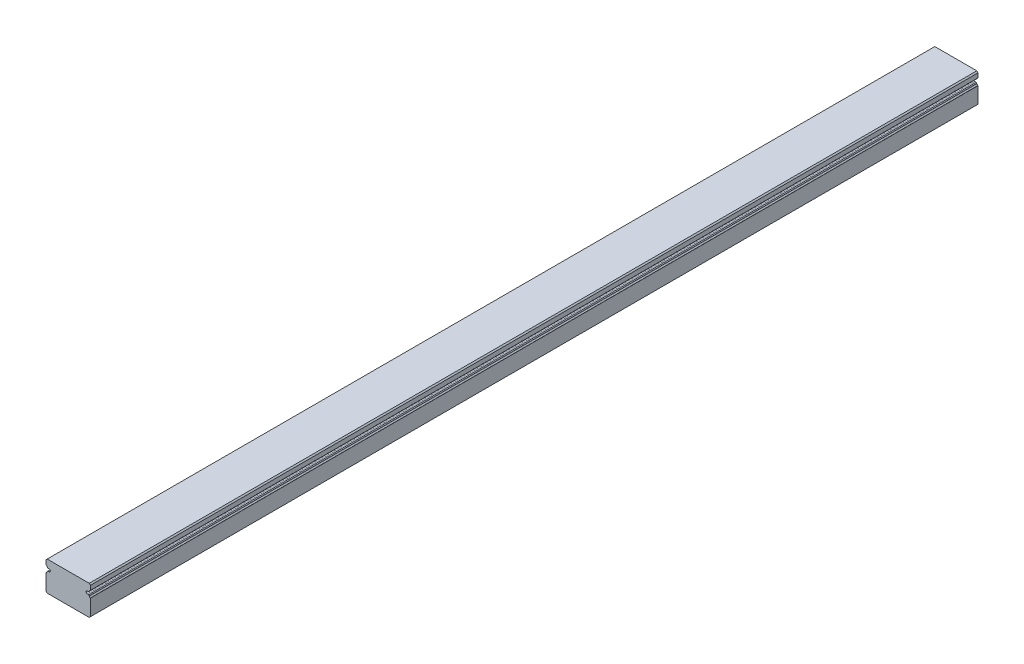
from build123d import *

# Parameters (mm, degrees)
EXTRUDE_273_DEPTH = 150


with BuildPart() as part:
    # Model → Extrude 273 (new, symmetric)
    with BuildSketch(Plane.XY):
        with BuildLine():
            Line((-7.1, -5), (7.1, -5))
            Line((7.1, -5), (7.5, -4.6))
            Line((7.5, -4.6), (7.5, 0.85))
            Line((7.5, 0.85), (7.463929973, 0.892081698))
            ThreePointArc((7.463929973, 0.892081698), (7.2158211, 1.027882975), (7.119563548, 1.293842528))
            Line((7.119563548, 1.293842528), (6.9, 1.55))
            Line((6.9, 1.55), (6.5, 1.55))
            ThreePointArc((6.5, 1.55), (6.05, 2), (6.5, 2.45))
            Line((6.5, 2.45), (6.9, 2.45))
            Line((6.9, 2.45), (7.119563548, 2.706157472))
            ThreePointArc((7.119563548, 2.706157472), (7.2158211, 2.972117025), (7.463929973, 3.107918302))
            Line((7.463929973, 3.107918302), (7.5, 3.15))
            Line((7.5, 3.15), (7.5, 4.6))
            Line((7.5, 4.6), (7.1, 5))
            Line((7.1, 5), (-7.1, 5))
            Line((-7.1, 5), (-7.5, 4.6))
            Line((-7.5, 4.6), (-7.5, 3.15))
            Line((-7.5, 3.15), (-7.463929973, 3.107918302))
            ThreePointArc((-7.463929973, 3.107918302), (-7.2158211, 2.972117025), (-7.119563548, 2.706157472))
            Line((-7.119563548, 2.706157472), (-6.9, 2.45))
            Line((-6.9, 2.45), (-6.5, 2.45))
            ThreePointArc((-6.5, 2.45), (-6.05, 2), (-6.5, 1.55))
            Line((-6.5, 1.55), (-6.9, 1.55))
            Line((-6.9, 1.55), (-7.119563548, 1.293842528))
            ThreePointArc((-7.119563548, 1.293842528), (-7.2158211, 1.027882975), (-7.463929973, 0.892081698))
            Line((-7.463929973, 0.892081698), (-7.5, 0.85))
            Line((-7.5, 0.85), (-7.5, -4.6))
            Line((-7.5, -4.6), (-7.1, -5))
        make_face()
    extrude(amount=EXTRUDE_273_DEPTH, both=True)


solid = part.part
